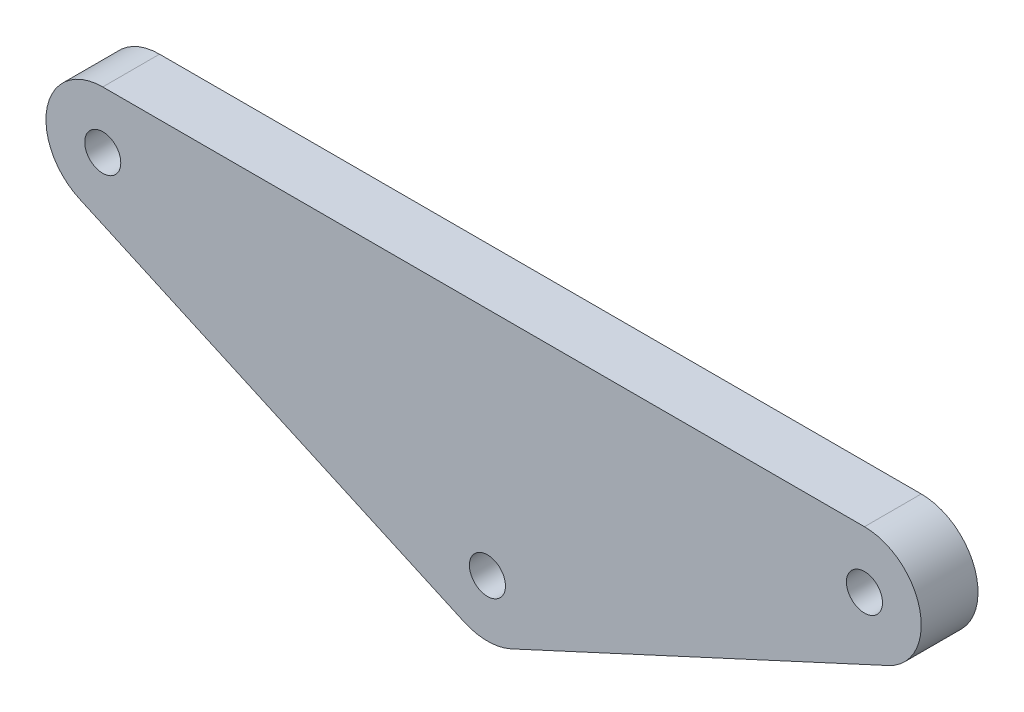
from build123d import *

# Parameters (mm, degrees)
BOSS_EXTRUDE1_DEPTH = 2.5
SKETCH2_R           = 1.5875
CUT_EXTRUDE1_DEPTH  = 44.859171323


with BuildPart() as part:
    # Sketch1 → Boss-Extrude1 (new, symmetric)
    with BuildSketch(Plane.XY):
        with BuildLine():
            Line((-33.54, 5), (33.54, 5))
            ThreePointArc((33.54, 5), (38.423518139, 1.072963462), (35.635934611, -4.539499764))
            Line((35.635934611, -4.539499764), (2.434033336, -19.869165506))
            ThreePointArc((2.434033336, -19.869165506), (0.357155817, -20.329629424), (-1.723171376, -19.885010467))
            Line((-1.723171376, -19.885010467), (-35.601270101, -4.555344726))
            ThreePointArc((-35.601270101, -4.555344726), (-38.42757218, 1.054342537), (-33.54, 5))
        make_face()
    extrude(amount=BOSS_EXTRUDE1_DEPTH, both=True)

    # Sketch2 → Cut-Extrude1 (cut, through all)
    with BuildSketch(Plane.XY.offset(2.5)):
        with Locations((-33.54, 0)):
            Circle(SKETCH2_R)
        with Locations((33.54, 0)):
            Circle(SKETCH2_R)
        with Locations((0.338098725, -15.329665742)):
            Circle(SKETCH2_R)
    extrude(amount=-CUT_EXTRUDE1_DEPTH, mode=Mode.SUBTRACT)


solid = part.part
